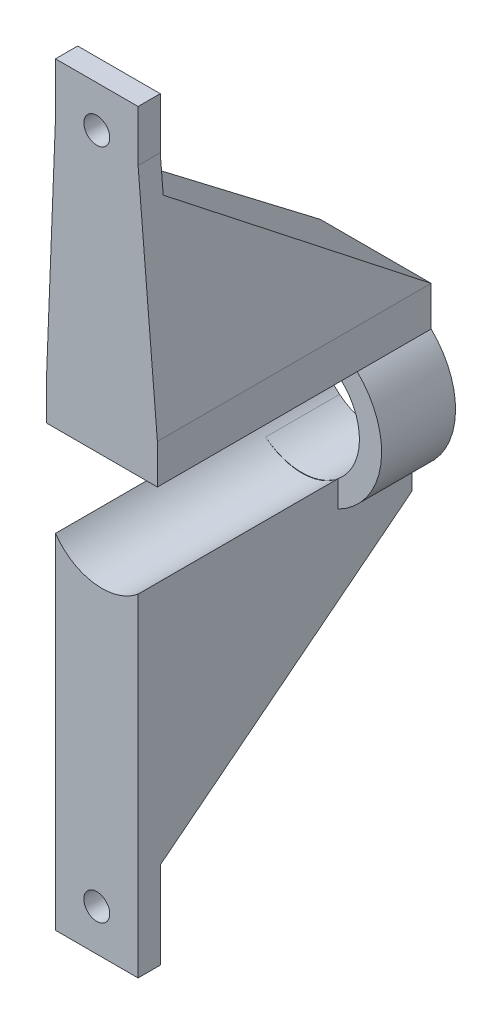
from build123d import *

# Parameters (mm, degrees)
EXTRUDE_THIN1_DEPTH = 10
SKETCH2_W           = 17.824072676
SKETCH2_H           = 3.5
CUT_EXTRUDE1_DEPTH  = 10
SKETCH3_W           = 9
SKETCH3_H           = 3
BOSS_EXTRUDE1_DEPTH = 10
SKETCH4_R           = 1.75
CUT_EXTRUDE2_DEPTH  = 10
SKETCH5_W           = 15
SKETCH5_H           = 5.349927867
BOSS_EXTRUDE2_DEPTH = 27.0318
SKETCH6_W           = 9
SKETCH6_H           = 3.75
CUT_EXTRUDE3_DEPTH  = 13
BOSS_EXTRUDE3_DEPTH = 15
CUT_EXTRUDE8_REACH  = 67.42
SKETCH8_R           = 1.75
BOSS_EXTRUDE4_DEPTH = 37.0318
CUT_EXTRUDE6_DEPTH  = 11.169767789
SKETCH13_R          = 1.75
CUT_EXTRUDE9_DEPTH  = 3


with BuildPart() as part:
    # Sketch1 → Extrude-Thin1 (new body)
    with BuildSketch(Plane.XY):
        with BuildLine():
            Line((7.5, 8.014450411), (7.5, 13.364378278))
            Line((7.5, 13.364378278), (-7.5, 13.364378278))
            Line((-7.5, 13.364378278), (-7.5, 8.014450411))
            ThreePointArc((-7.5, 8.014450411), (0, -10.556649897), (7.5, 8.014450411))
        make_face()
        with BuildLine():
            Line((4.5, 6.614378278), (4.5, 10.364378278))
            Line((4.5, 10.364378278), (-4.5, 10.364378278))
            Line((-4.5, 10.364378278), (-4.5, 6.614378278))
            ThreePointArc((-4.5, 6.614378278), (0, -7.556649897), (4.5, 6.614378278))
        make_face(mode=Mode.SUBTRACT)
    extrude(amount=-EXTRUDE_THIN1_DEPTH)

    # Sketch2 → Cut-Extrude1 (cut)
    with BuildSketch(Plane(origin=(0, 0, -10), x_dir=(-1, 0, 0), z_dir=(0, 0, -1))):
        with Locations((8.912036338, 0)):
            Rectangle(SKETCH2_W, SKETCH2_H)
    extrude(amount=-CUT_EXTRUDE1_DEPTH, mode=Mode.SUBTRACT)

    # Sketch3 → Boss-Extrude1 (add)
    with BuildSketch(Plane.XY):
        with Locations((-12.153104343, 3.25)):
            Rectangle(SKETCH3_W, SKETCH3_H)
        with Locations((-12.04099167, -3.25)):
            Rectangle(SKETCH3_W, SKETCH3_H)
    extrude(amount=-BOSS_EXTRUDE1_DEPTH)

    # Sketch4 → Cut-Extrude2 (cut)
    with BuildSketch(Plane(origin=(0, 4.75, 0), x_dir=(1, 0, 0), z_dir=(0, 1, 0))):
        with Locations((-13.233947273, 5)):
            Circle(SKETCH4_R)
    extrude(amount=-CUT_EXTRUDE2_DEPTH, mode=Mode.SUBTRACT)

    # Sketch5 → Boss-Extrude2 (add)
    with BuildSketch(Plane.XY):
        with Locations((0, 10.689414345)):
            Rectangle(SKETCH5_W, SKETCH5_H)
    extrude(amount=BOSS_EXTRUDE2_DEPTH)

    # Sketch6 → Cut-Extrude3 (cut)
    with BuildSketch(Plane(origin=(0, 0, -10), x_dir=(-1, 0, 0), z_dir=(0, 0, -1))):
        with Locations((0, 8.489378278)):
            Rectangle(SKETCH6_W, SKETCH6_H)
    extrude(amount=-CUT_EXTRUDE3_DEPTH, mode=Mode.SUBTRACT)

    # Sketch7 → Boss-Extrude3 (add)
    with BuildSketch(Plane.ZY.offset(7.5)):
        Polygon((27.0318, 13.364378278), (-10, 13.364378278), (24.0318, 39.609893084), (24.0318, 51.294233998), (27.0318, 51.294233998), align=None)
    extrude(amount=-BOSS_EXTRUDE3_DEPTH)

    # Cut-Extrude8: up to this face of the body (flat: up to its plane)
    cut_extrude8_end = Plane(part.part.faces().sort_by_distance((0, 29.654342205, 27.0318))[0])
    # Sketch8 → Cut-Extrude8 (cut, up to the picked face)
    with BuildSketch(Plane(origin=(0, 0, -10), x_dir=(-1, 0, 0), z_dir=(0, 0, -1)), mode=Mode.PRIVATE) as cut_extrude8_sk1:
        with Locations(Location((0.697367247, 45.709350103, 0), (0, 0, 90))):
            Circle(SKETCH8_R)
    cut_extrude8_tool1 = split(extrude(cut_extrude8_sk1.sketch, amount=-CUT_EXTRUDE8_REACH, mode=Mode.PRIVATE), bisect_by=cut_extrude8_end, keep=Keep.BOTH, mode=Mode.PRIVATE)
    # Sketch8 → Cut-Extrude8 (cut, up to the picked face)
    with BuildSketch(Plane(origin=(0, 0, -10), x_dir=(-1, 0, 0), z_dir=(0, 0, -1)), mode=Mode.PRIVATE) as cut_extrude8_sk2:
        Polygon((6.282251141, 44.365676022), (6.282251141, 47.053024185), (6.282251141, 51.294233998), (7.5, 51.294233998), (7.5, 39.609893084), (7.5, 13.364378278), align=None)
    cut_extrude8_tool2 = split(extrude(cut_extrude8_sk2.sketch, amount=-CUT_EXTRUDE8_REACH, mode=Mode.PRIVATE), bisect_by=cut_extrude8_end, keep=Keep.BOTH, mode=Mode.PRIVATE)
    # Sketch8 → Cut-Extrude8 (cut, up to the picked face)
    with BuildSketch(Plane(origin=(0, 0, -10), x_dir=(-1, 0, 0), z_dir=(0, 0, -1)), mode=Mode.PRIVATE) as cut_extrude8_sk3:
        Polygon((-4.887516648, 47.053024185), (-4.887516648, 44.365676022), (-7.5, 13.364378278), (-7.5, 39.609893084), (-7.5, 51.294233998), (-4.887516648, 51.294233998), align=None)
    cut_extrude8_tool3 = split(extrude(cut_extrude8_sk3.sketch, amount=-CUT_EXTRUDE8_REACH, mode=Mode.PRIVATE), bisect_by=cut_extrude8_end, keep=Keep.BOTH, mode=Mode.PRIVATE)
    add(cut_extrude8_tool1.solids().sort_by(Axis((-0.697367, 45.70935, -10), (0, 0, 1)))[0], mode=Mode.SUBTRACT)
    add(cut_extrude8_tool2.solids().sort_by(Axis((-7.031388, 38.294234, -10), (0, 0, 1)))[0], mode=Mode.SUBTRACT)
    add(cut_extrude8_tool3.solids().sort_by(Axis((6.494669, 38.294234, -10), (0, 0, 1)))[0], mode=Mode.SUBTRACT)

    # Sketch11 → Boss-Extrude4 (add)
    with BuildSketch(Plane(origin=(0, 0, -10), x_dir=(-1, 0, 0), z_dir=(0, 0, -1))):
        with BuildLine():
            Line((6.282251141, -43.878975815), (6.282251141, -46.566323978))
            Line((6.282251141, -46.566323978), (6.282251141, -50.807533791))
            Line((6.282251141, -50.807533791), (2.041041328, -50.807533791))
            Line((2.041041328, -50.807533791), (-0.646306835, -50.807533791))
            Line((-0.646306835, -50.807533791), (-4.887516648, -50.807533791))
            Line((-4.887516648, -50.807533791), (-4.887516648, -46.566323978))
            Line((-4.887516648, -46.566323978), (-4.887516648, -43.878975815))
            Line((-4.887516648, -43.878975815), (-4.887516648, -5.83548046))
            ThreePointArc((-4.887516648, -5.83548046), (1.037871953, -7.540787293), (6.282251141, -4.298135849))
            Line((6.282251141, -4.298135849), (6.282251141, -43.878975815))
        make_face()
    extrude(amount=-BOSS_EXTRUDE4_DEPTH)

    # Sketch12 → Cut-Extrude6 (cut)
    with BuildSketch(Plane(origin=(-6.282251141, 0, 0), x_dir=(0, 0, -1), z_dir=(1, 0, 0))):
        Polygon((10, -12.309364669), (10, -50.807533791), (-24.0318, -50.807533791), (-24.0318, -39.062586463), align=None)
    extrude(amount=CUT_EXTRUDE6_DEPTH, mode=Mode.SUBTRACT)

    # Sketch13 → Cut-Extrude9 (cut)
    with BuildSketch(Plane.XY.offset(27.0318)):
        with Locations((-0.697367247, -45.222649897)):
            Circle(SKETCH13_R)
    extrude(amount=-CUT_EXTRUDE9_DEPTH, mode=Mode.SUBTRACT)


solid = part.part
